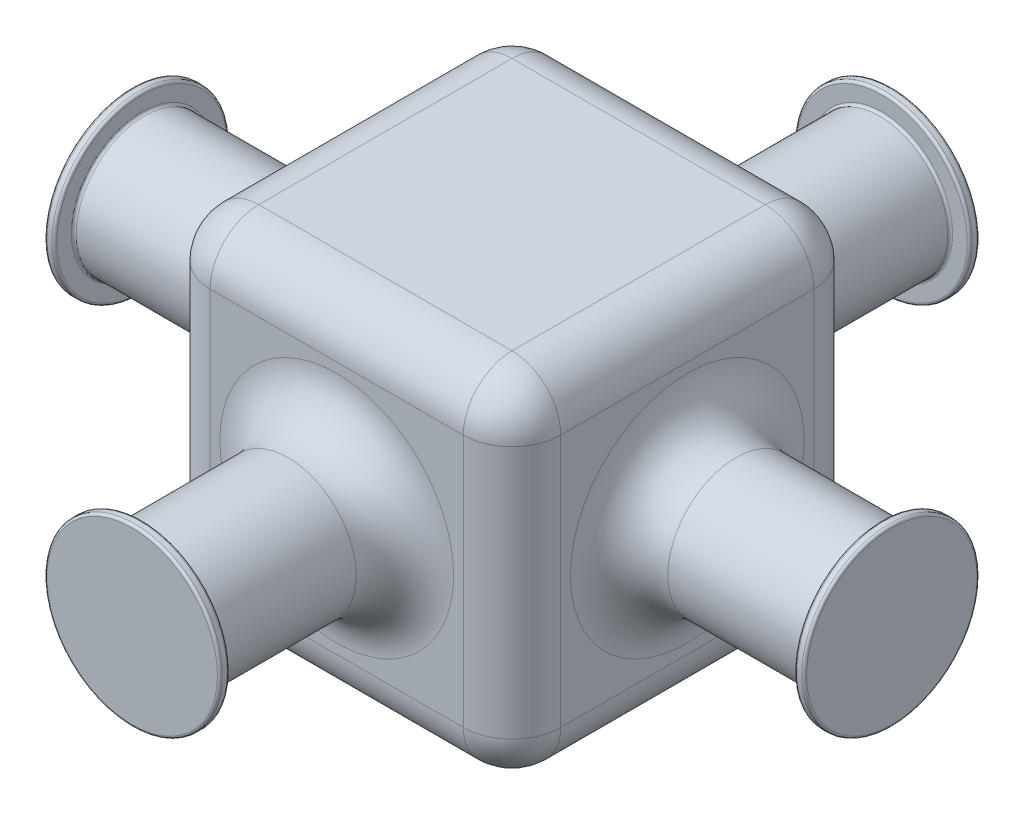
from build123d import *

# Parameters (mm, degrees)
SKETCH1_W           = 36
SKETCH1_H           = 36
BOSS_EXTRUDE1_DEPTH = 18
SKETCH3_R           = 7
BOSS_EXTRUDE2_DEPTH = 20
SKETCH4_R           = 9
BOSS_EXTRUDE3_DEPTH = 1
FILLET1_R           = 0.25
SKETCH5_R           = 7
BOSS_EXTRUDE4_DEPTH = 20
SKETCH6_R           = 9
BOSS_EXTRUDE5_DEPTH = 1
FILLET2_R           = 0.25
FILLET3_R           = 0.25
FILLET4_R           = 5


with BuildPart() as part:
    # Sketch1 → Boss-Extrude1 (new, symmetric)
    with BuildSketch(Plane.XY):
        Rectangle(SKETCH1_W, SKETCH1_H)
    extrude(amount=BOSS_EXTRUDE1_DEPTH, both=True)

    # Sketch3 → Boss-Extrude2 (add)
    with BuildSketch(Plane(origin=(0, 0, -18), x_dir=(-1, 0, 0), z_dir=(0, 0, -1))):
        Circle(SKETCH3_R)
    boss_extrude2 = extrude(amount=BOSS_EXTRUDE2_DEPTH)

    # Sketch4 → Boss-Extrude3 (add)
    with BuildSketch(Plane(origin=(0, 0, -38), x_dir=(-1, 0, 0), z_dir=(0, 0, -1))):
        Circle(SKETCH4_R)
    boss_extrude3 = extrude(amount=BOSS_EXTRUDE3_DEPTH)

    # Fillet1
    fillet1_edges = [part.edges().sort_by_distance(p)[0] for p in [
        (9, 0, -38),
        (9, 0, -39),
    ]]
    fillet(fillet1_edges, radius=FILLET1_R)

    # Mirror1: Boss-Extrude2, Boss-Extrude3 across plane
    add(boss_extrude2.mirror(Plane.XY))
    add(boss_extrude3.mirror(Plane.XY))

    # Sketch5 → Boss-Extrude4 (add)
    with BuildSketch(Plane.ZY.offset(18)):
        Circle(SKETCH5_R)
    boss_extrude4 = extrude(amount=BOSS_EXTRUDE4_DEPTH)

    # Sketch6 → Boss-Extrude5 (add)
    with BuildSketch(Plane.ZY.offset(38)):
        Circle(SKETCH6_R)
    boss_extrude5 = extrude(amount=BOSS_EXTRUDE5_DEPTH)

    # Mirror2: Boss-Extrude4, Boss-Extrude5 across plane
    add(boss_extrude4.mirror(Plane(origin=(0, 0, 0), x_dir=(0, 0, 1), z_dir=(1, 0, 0))))
    add(boss_extrude5.mirror(Plane(origin=(0, 0, 0), x_dir=(0, 0, 1), z_dir=(1, 0, 0))))

    # Fillet2
    fillet2_edges = [part.edges().sort_by_distance(p)[0] for p in [
        (-38, 0, -9),
        (-39, 0, -9),
        (39, 0, -9),
        (38, 0, -9),
    ]]
    fillet(fillet2_edges, radius=FILLET2_R)

    # Fillet3
    fillet3_edges = [part.edges().sort_by_distance(p)[0] for p in [
        (7, 0, -38),
        (7, 0, 38),
        (9, 0, 39),
        (9, 0, 38),
        (-38, 0, -7),
        (38, 0, -7),
    ]]
    fillet(fillet3_edges, radius=FILLET3_R)

    # Fillet4
    fillet4_edges = [part.edges().sort_by_distance(p)[0] for p in [
        (-18, 0, 18),
        (7, 0, -18),
        (0, -18, 18),
        (7, 0, 18),
        (-18, 0, -7),
        (18, 0, -7),
        (18, 0, 18),
        (0, -18, -18),
        (-18, 0, -18),
        (0, 18, -18),
        (18, 0, -18),
        (18, -18, 0),
        (-18, -18, 0),
        (-18, 18, 0),
        (18, 18, 0),
        (0, 18, 18),
    ]]
    fillet(fillet4_edges, radius=FILLET4_R)


solid = part.part
